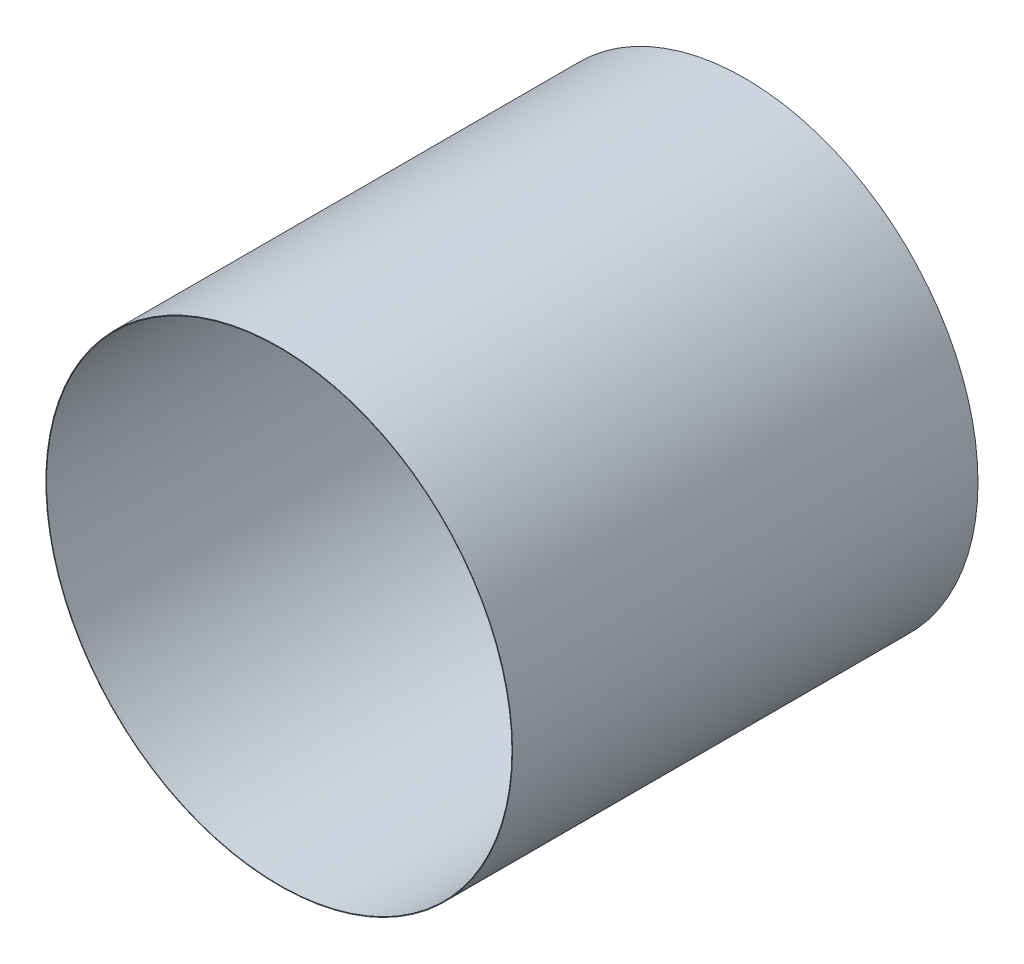
from build123d import *

# Parameters (mm, degrees)
SKETCH1_R           = 75.2
SKETCH1_R_2         = 75
BOSS_EXTRUDE1_DEPTH = 150


with BuildPart() as part:
    # Sketch1 → Boss-Extrude1 (new body)
    with BuildSketch(Plane.XY):
        Circle(SKETCH1_R)
        Circle(SKETCH1_R_2, mode=Mode.SUBTRACT)
    extrude(amount=BOSS_EXTRUDE1_DEPTH)


solid = part.part
